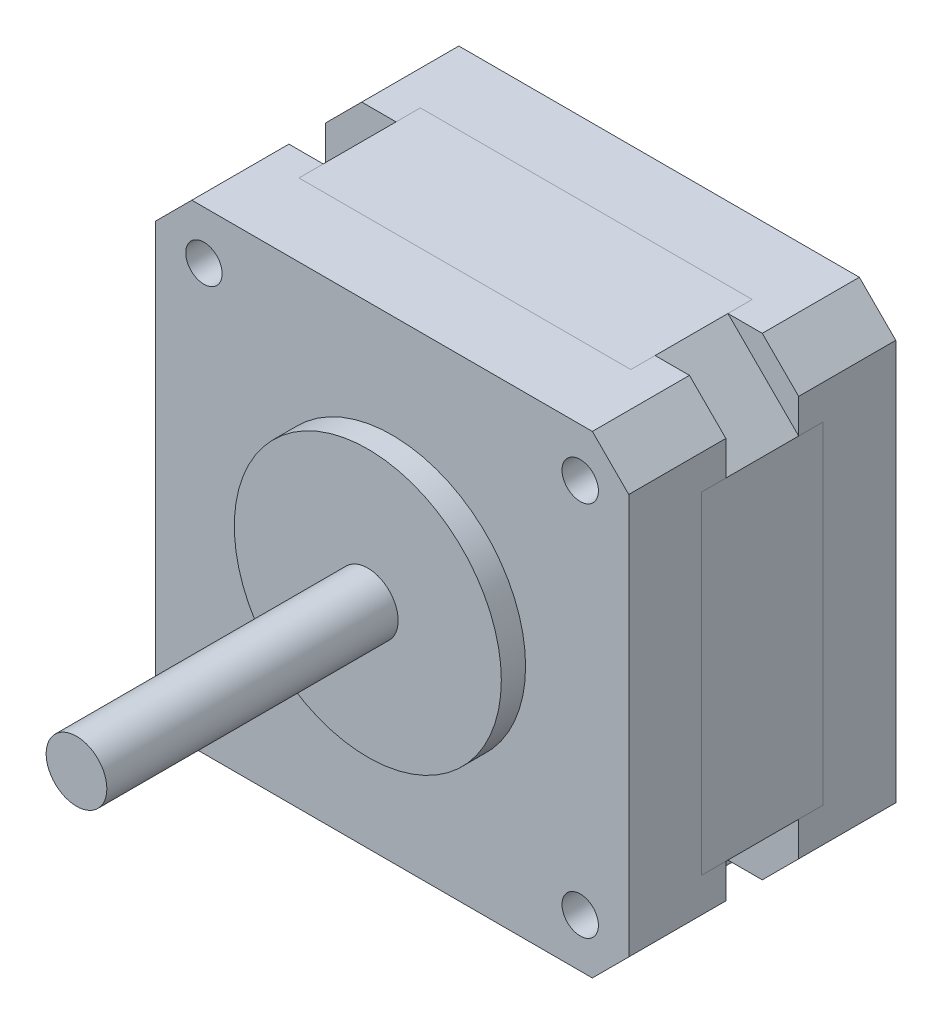
from build123d import *

# Parameters (mm, degrees)
BOSS_EXTRUDE1_DEPTH  = 8
CUT_EXTRUDE1_DEPTH   = 2
BOSS_EXTRUDE7_DEPTH  = 8
EXTRUDE_3_DEPTH      = 10
CUT_EXTRUDE2_DEPTH   = 2
SKETCH10_R           = 1.5
CUT_EXTRUDE3_DEPTH   = 5.5
SKETCH11_R           = 11
BOSS_EXTRUDE9_DEPTH  = 2
SKETCH12_R           = 2.5
BOSS_EXTRUDE10_DEPTH = 24
SKETCH14_R           = 1.5
CUT_EXTRUDE5_DEPTH   = 5.5
SKETCH16_R           = 4
CUT_EXTRUDE6_DEPTH   = 2
SKETCH17_R           = 2.5
BOSS_EXTRUDE11_DEPTH = 1
SKETCH18_R           = 2.75
CUT_EXTRUDE7_DEPTH   = 1
SKETCH_3_W           = 22
SKETCH_3_H           = 7.5
EXTRUDE_4_DEPTH      = 3


with BuildPart() as part:
    # Sketch1 → Boss-Extrude1 (new body)
    with BuildSketch(Plane.XY):
        Polygon((-19.5, 16.5), (-16.5, 19.5), (16.5, 19.5), (19.5, 16.5), (19.5, -16.5), (16.5, -19.5), (-16.5, -19.5), (-19.5, -16.5), align=None)
    extrude(amount=BOSS_EXTRUDE1_DEPTH)

    # Sketch2 → Cut-Extrude1 (cut)
    with BuildSketch(Plane.XY.offset(8)):
        Polygon((-19.5, 13.671572875), (-13.671572875, 19.5), (13.671572875, 19.5), (19.5, 13.671572875), (19.5, -13.671572875), (13.671572875, -19.5), (-13.671572875, -19.5), (-19.5, -13.671572875), align=None)
    extrude(amount=-CUT_EXTRUDE1_DEPTH, mode=Mode.SUBTRACT)

    # Sketch14 → Cut-Extrude5 (cut)
    with BuildSketch(Plane(origin=(0, 0, 0), x_dir=(-1, 0, 0), z_dir=(0, 0, -1))):
        with Locations(Location((15.5, -15.5, 0), (0, 0, 180))):
            Circle(SKETCH14_R)
        with Locations(Location((-15.5, -15.5, 0), (0, 0, 180))):
            Circle(SKETCH14_R)
        with Locations(Location((-15.5, 15.5, 0), (0, 0, 180))):
            Circle(SKETCH14_R)
        with Locations(Location((15.5, 15.5, 0), (0, 0, 180))):
            Circle(SKETCH14_R)
    extrude(amount=-CUT_EXTRUDE5_DEPTH, mode=Mode.SUBTRACT)

    # Sketch16 → Cut-Extrude6 (cut)
    with BuildSketch(Plane(origin=(0, 0, 0), x_dir=(-1, 0, 0), z_dir=(0, 0, -1))):
        Circle(SKETCH16_R)
    extrude(amount=-CUT_EXTRUDE6_DEPTH, mode=Mode.SUBTRACT)

    # Sketch18 → Cut-Extrude7 (cut)
    with BuildSketch(Plane(origin=(0, 0, 0), x_dir=(-1, 0, 0), z_dir=(0, 0, -1))):
        with Locations((15.5, -15.5)):
            Circle(SKETCH18_R)
        with Locations((-15.5, -15.5)):
            Circle(SKETCH18_R)
        with Locations((-15.5, 15.5)):
            Circle(SKETCH18_R)
        with Locations((15.5, 15.5)):
            Circle(SKETCH18_R)
    extrude(amount=-CUT_EXTRUDE7_DEPTH, mode=Mode.SUBTRACT)


with BuildPart() as body_2:
    # Sketch8 → Boss-Extrude7 (new body)
    with BuildSketch(Plane(origin=(0, 0, 22), x_dir=(-1, 0, 0), z_dir=(0, 0, -1))):
        Polygon((19.5, 16.5), (16.5, 19.5), (-16.5, 19.5), (-19.5, 16.5), (-19.5, -16.5), (-16.5, -19.5), (16.5, -19.5), (19.5, -16.5), align=None)
    extrude(amount=BOSS_EXTRUDE7_DEPTH)

    # Sketch9 → Cut-Extrude2 (cut)
    with BuildSketch(Plane(origin=(0, 0, 14), x_dir=(-1, 0, 0), z_dir=(0, 0, -1))):
        Polygon((13.671572875, -19.5), (19.5, -13.671572875), (19.5, 13.671572875), (13.671572875, 19.5), (-13.671572875, 19.5), (-19.5, 13.671572875), (-19.5, -13.671572875), (-13.671572875, -19.5), align=None)
    extrude(amount=-CUT_EXTRUDE2_DEPTH, mode=Mode.SUBTRACT)

    # Sketch10 → Cut-Extrude3 (cut)
    with BuildSketch(Plane.XY.offset(22)):
        with Locations((-15.5, 15.5)):
            Circle(SKETCH10_R)
        with Locations((15.5, 15.5)):
            Circle(SKETCH10_R)
        with Locations((15.5, -15.5)):
            Circle(SKETCH10_R)
        with Locations((-15.5, -15.5)):
            Circle(SKETCH10_R)
    extrude(amount=-CUT_EXTRUDE3_DEPTH, mode=Mode.SUBTRACT)


with BuildPart() as body_3:
    # 草图4 → 凸台-拉伸3 (new body)
    with BuildSketch(Plane.XY.offset(6)):
        Polygon((-13.671572875, 19.5), (-19.5, 13.671572875), (-19.5, -13.671572875), (-13.671572875, -19.5), (13.671572875, -19.5), (19.5, -13.671572875), (19.5, 13.671572875), (13.671572875, 19.5), align=None)
    extrude(amount=EXTRUDE_3_DEPTH)


with BuildPart() as body_4:
    # Sketch11 → Boss-Extrude9 (new body)
    with BuildSketch(Plane.XY.offset(22)):
        Circle(SKETCH11_R)
    extrude(amount=BOSS_EXTRUDE9_DEPTH)


with BuildPart() as body_5:
    # Sketch12 → Boss-Extrude10 (new body)
    with BuildSketch(Plane.XY.offset(24)):
        Circle(SKETCH12_R)
    extrude(amount=BOSS_EXTRUDE10_DEPTH)


with BuildPart() as body_6:
    # Sketch17 → Boss-Extrude11 (new body)
    with BuildSketch(Plane(origin=(0, 0, 2), x_dir=(-1, 0, 0), z_dir=(0, 0, -1))):
        Circle(SKETCH17_R)
    extrude(amount=BOSS_EXTRUDE11_DEPTH)


with BuildPart() as body_7:
    # 草图3 → 凸台-拉伸4 (new body)
    with BuildSketch(Plane(origin=(0, -19.5, 0), x_dir=(-1, 0, 0), z_dir=(0, -1, 0))):
        with Locations((0, -3.75)):
            Rectangle(SKETCH_3_W, SKETCH_3_H)
    extrude(amount=EXTRUDE_4_DEPTH)


solid = Compound([part.part, body_2.part, body_3.part, body_4.part, body_5.part, body_6.part, body_7.part])
